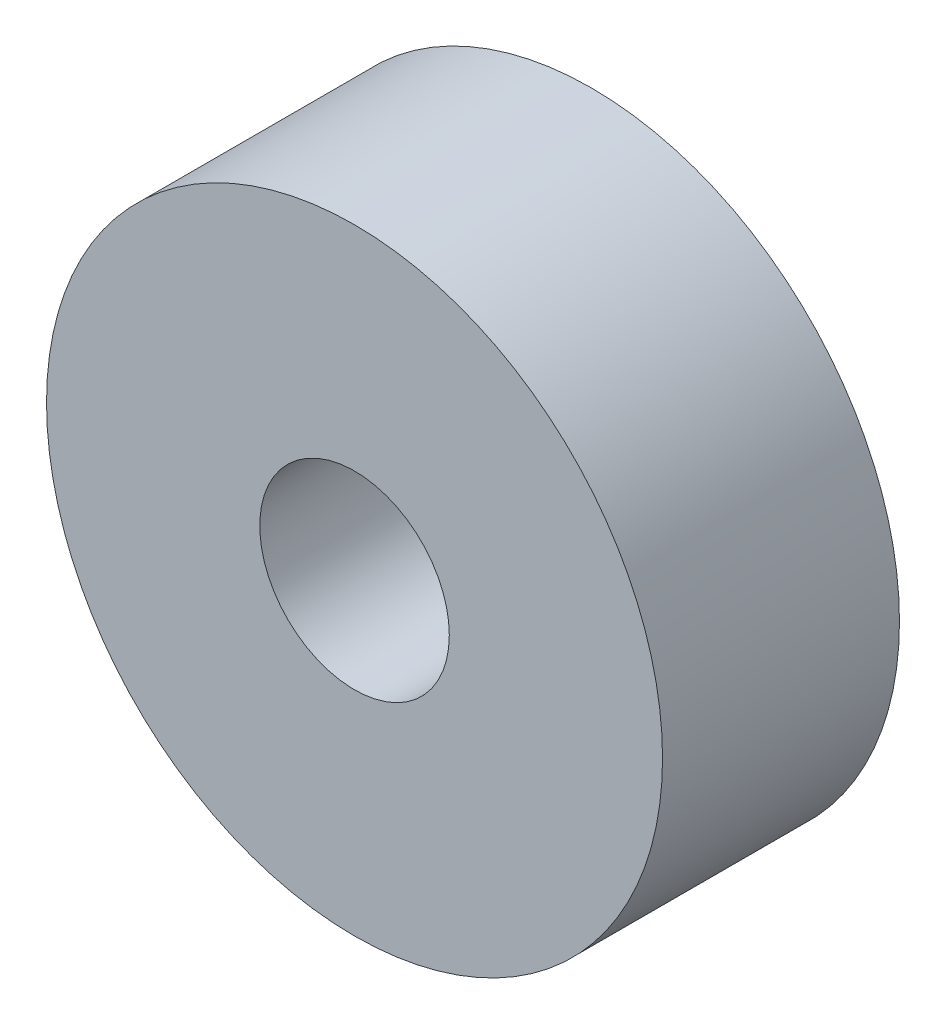
from build123d import *

# Parameters (mm, degrees)
SKETCH1_R           = 6.5
BOSS_EXTRUDE1_DEPTH = 5
SKETCH2_R           = 2
CUT_EXTRUDE1_DEPTH  = 11.464224768


with BuildPart() as part:
    # Sketch1 → Boss-Extrude1 (new body)
    with BuildSketch(Plane.XY):
        Circle(SKETCH1_R)
    extrude(amount=BOSS_EXTRUDE1_DEPTH)

    # Sketch2 → Cut-Extrude1 (cut, through all)
    with BuildSketch(Plane.XY.offset(5)):
        Circle(SKETCH2_R)
    extrude(amount=-CUT_EXTRUDE1_DEPTH, mode=Mode.SUBTRACT)


solid = part.part
